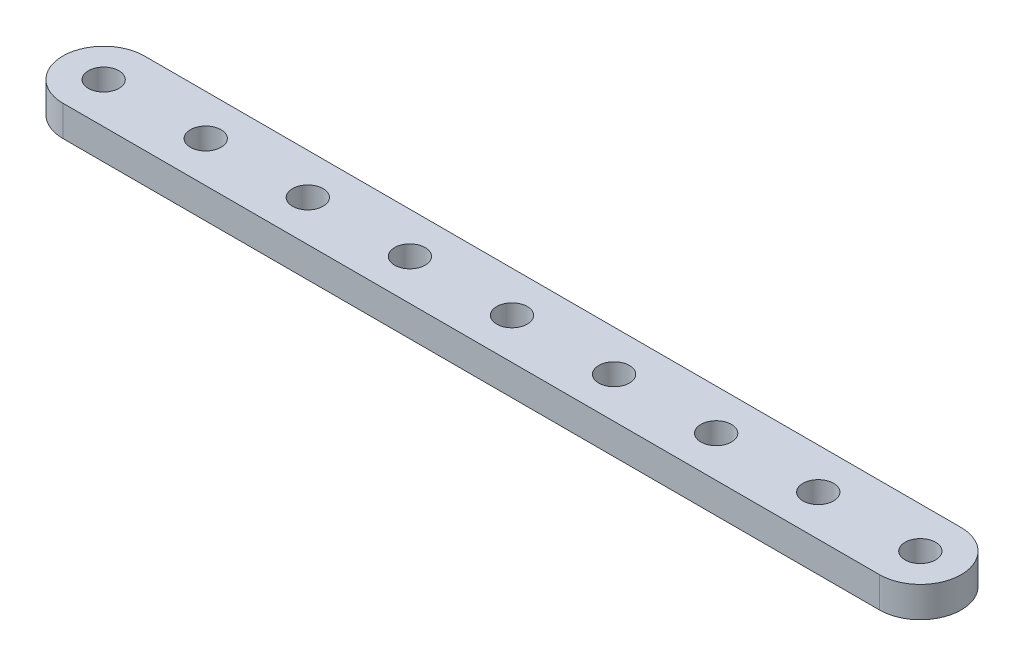
from build123d import *

# Parameters (mm, degrees)
OUTER_BODY_DEPTH = 3
SKETCH8_R        = 1.5
HOLES_DEPTH      = 75.168726563


with BuildPart() as part:
    # Sketch1 → Outer Body (new body)
    with BuildSketch(Plane(origin=(0, 0, 0), x_dir=(1, 0, 0), z_dir=(0, 1, 0))):
        with BuildLine():
            Line((-10, 4), (70, 4))
            ThreePointArc((70, 4), (74, 0), (70, -4))
            Line((70, -4), (-10, -4))
            ThreePointArc((-10, -4), (-14, 0), (-10, 4))
        make_face()
    extrude(amount=OUTER_BODY_DEPTH)

    # Sketch8 → Holes (cut, through all)
    with BuildSketch(Plane(origin=(0, 3, 0), x_dir=(1, 0, 0), z_dir=(0, 1, 0))):
        with Locations(Location((-10, 0, 0), (0, 0, 270))):
            Circle(SKETCH8_R)
        with Locations(Location((0, 0, 0), (0, 0, 270))):
            Circle(SKETCH8_R)
        with Locations(Location((50, 0, 0), (0, 0, 270))):
            Circle(SKETCH8_R)
        with Locations(Location((70, 0, 0), (0, 0, 270))):
            Circle(SKETCH8_R)
        with Locations(Location((60, 0, 0), (0, 0, 270))):
            Circle(SKETCH8_R)
        with Locations(Location((10, 0, 0), (0, 0, 270))):
            Circle(SKETCH8_R)
        with Locations(Location((20, 0, 0), (0, 0, 270))):
            Circle(SKETCH8_R)
        with Locations(Location((30, 0, 0), (0, 0, 270))):
            Circle(SKETCH8_R)
        with Locations(Location((40, 0, 0), (0, 0, 270))):
            Circle(SKETCH8_R)
    extrude(amount=-HOLES_DEPTH, mode=Mode.SUBTRACT)


solid = part.part
